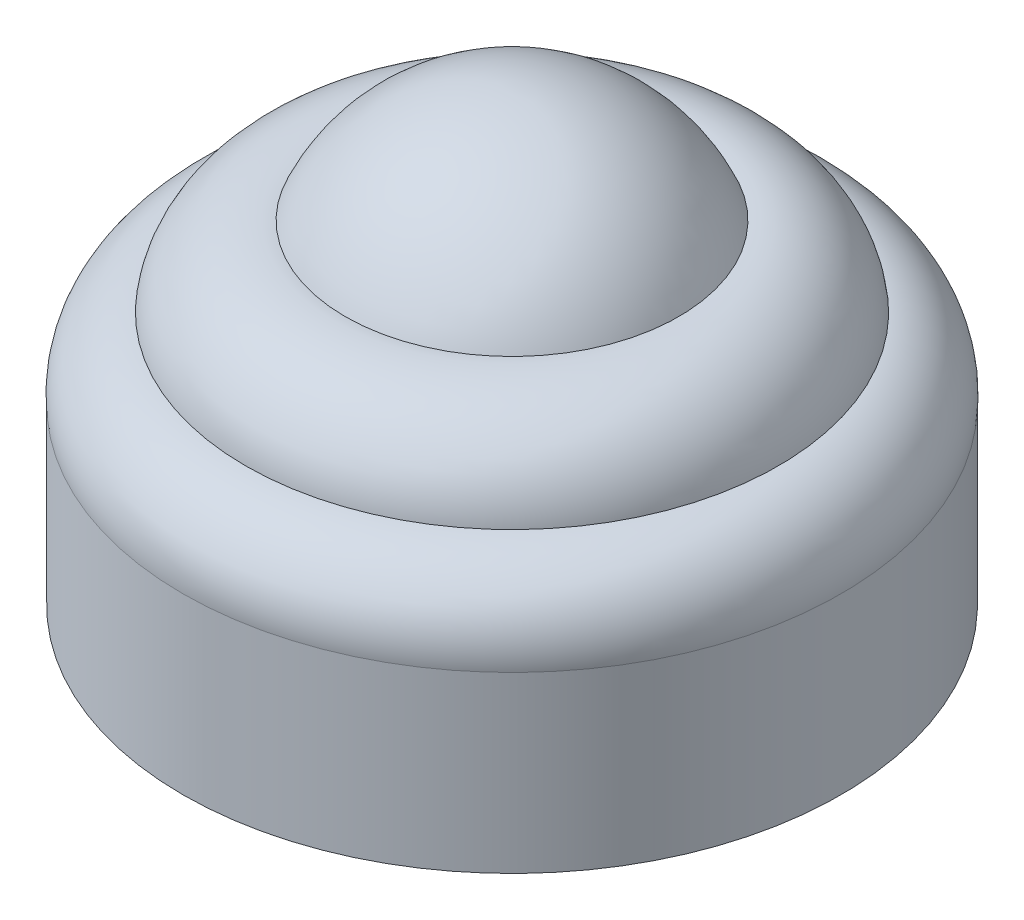
from build123d import *


with BuildPart() as part:
    # 스케치1 → 회전2 (revolve)
    with BuildSketch(Plane(origin=(0, 0, 0), x_dir=(0, 0, -1), z_dir=(1, 0, 0))):
        with BuildLine():
            Line((17.197310172, 20.655102766), (17.197310172, 12.989859799))
            Line((17.197310172, 12.989859799), (31.690436017, 12.989859799))
            Line((31.690436017, 12.989859799), (31.690436017, 32.489859799))
            ThreePointArc((31.690436017, 32.489859799), (27.292705315, 31.172670935), (24.343135091, 27.654850968))
            ThreePointArc((24.343135091, 27.654850968), (21.426295059, 26.810829531), (19.960590975, 24.151498885))
            ThreePointArc((19.960590975, 24.151498885), (17.854823227, 22.975595018), (17.197310172, 20.655102766))
        make_face()
    revolve(axis=Axis((0, 27.654850968, -31.690436017), (0, -1, 0)))


solid = part.part
